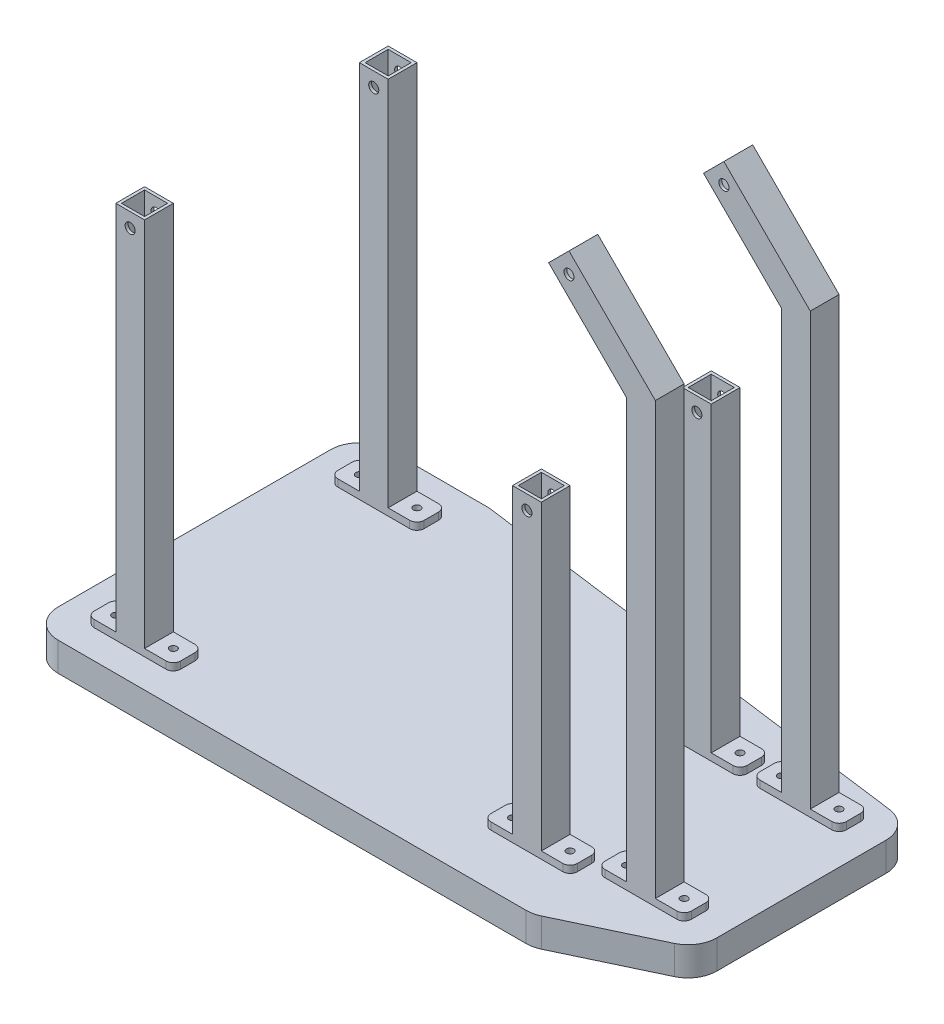
from build123d import *

# Parameters (mm, degrees)
SKETCH4_W               = 25.4
SKETCH4_H               = 25.4
SKETCH4_W_2             = 20.32
SKETCH4_H_2             = 20.32
EXTRUDE_THIN1_DEPTH     = 266.446
EXTRUDE_THIN1_2_DEPTH   = 266.446
SKETCH4_3_W             = 25.4
SKETCH4_3_H             = 25.4
SKETCH4_3_W_2           = 20.32
SKETCH4_3_H_2           = 20.32
EXTRUDE_THIN2_DEPTH     = 327.406
EXTRUDE_THIN2_2_DEPTH   = 327.406
CUT_EXTRUDE1_DEPTH      = 543.779398371
CUT_EXTRUDE1_DEPTH_BACK = 543.779398371
SKETCH3_R               = 4.445
SKETCH5_R               = 4.445
BOSS_EXTRUDE1_DEPTH     = 25.4
CUT_EXTRUDE2_START      = -2.54
CUT_EXTRUDE2_DEPTH      = 20.32
SKETCH7_R               = 3.175
BOSS_EXTRUDE2_DEPTH     = 6.35
BOSS_EXTRUDE3_DEPTH     = 25.4
CUT_EXTRUDE3_DEPTH      = 656.090287432
CUT_EXTRUDE3_DEPTH_BACK = 656.090287432
SKETCH9_R               = 3.175


with BuildPart() as part:
    # Sketch4 → Extrude-Thin1 (new body)
    with BuildSketch(Plane(origin=(0, 31.75, 0), x_dir=(1, 0, 0), z_dir=(0, 1, 0))):
        with Locations((0, 12.7)):
            Rectangle(SKETCH4_W, SKETCH4_H)
        with Locations((0, 12.7)):
            Rectangle(SKETCH4_W_2, SKETCH4_H_2, mode=Mode.SUBTRACT)
    extrude(amount=EXTRUDE_THIN1_DEPTH)


with BuildPart() as body_2:
    # Sketch4 → Extrude-Thin1 2 (new body)
    with BuildSketch(Plane(origin=(0, 31.75, 0), x_dir=(1, 0, 0), z_dir=(0, 1, 0))):
        with Locations((0, 162.56)):
            Rectangle(SKETCH4_W, SKETCH4_H)
        with Locations((0, 162.56)):
            Rectangle(SKETCH4_W_2, SKETCH4_H_2, mode=Mode.SUBTRACT)
    extrude(amount=EXTRUDE_THIN1_2_DEPTH)


with BuildPart() as body_3:
    # Sketch4<3> → Extrude-Thin2 (new body)
    with BuildSketch(Plane(origin=(0, 31.75, 0), x_dir=(1, 0, 0), z_dir=(0, 1, 0))):
        with Locations((-329.692, -7.62)):
            Rectangle(SKETCH4_3_W, SKETCH4_3_H)
        with Locations((-329.692, -7.62)):
            Rectangle(SKETCH4_3_W_2, SKETCH4_3_H_2, mode=Mode.SUBTRACT)
    extrude(amount=EXTRUDE_THIN2_DEPTH)


with BuildPart() as body_4:
    # Sketch4<3> → Extrude-Thin2 2 (new body)
    with BuildSketch(Plane(origin=(0, 31.75, 0), x_dir=(1, 0, 0), z_dir=(0, 1, 0))):
        with Locations((-329.692, 207.264)):
            Rectangle(SKETCH4_3_W, SKETCH4_3_H)
        with Locations((-329.692, 207.264)):
            Rectangle(SKETCH4_3_W_2, SKETCH4_3_H_2, mode=Mode.SUBTRACT)
    extrude(amount=EXTRUDE_THIN2_2_DEPTH)


with BuildPart() as cut_extrude1_tool:
    # Sketch3 → Cut-Extrude1 (new, two sides: drawn at the far end of the back side and taken through both)
    with BuildSketch(Plane.XY.offset(-CUT_EXTRUDE1_DEPTH_BACK)):
        with Locations((0, 285.496)):
            Circle(SKETCH3_R)
        with Locations((23.114, 470.408)):
            Circle(SKETCH3_R)
        with Locations((-329.692, 346.456)):
            Circle(SKETCH3_R)
    extrude(amount=CUT_EXTRUDE1_DEPTH + CUT_EXTRUDE1_DEPTH_BACK)


with BuildPart() as part_1:
    add(part.part)

    # Cut-Extrude1: cut by cut_extrude1_tool
    add(cut_extrude1_tool.part, mode=Mode.SUBTRACT)



with BuildPart() as body_2_1:
    add(body_2.part)

    # Cut-Extrude1: cut by cut_extrude1_tool
    add(cut_extrude1_tool.part, mode=Mode.SUBTRACT)


with BuildPart() as body_3_1:
    add(body_3.part)

    # Cut-Extrude1: cut by cut_extrude1_tool
    add(cut_extrude1_tool.part, mode=Mode.SUBTRACT)


with BuildPart() as body_4_1:
    add(body_4.part)

    # Cut-Extrude1: cut by cut_extrude1_tool
    add(cut_extrude1_tool.part, mode=Mode.SUBTRACT)


with BuildPart() as body_5:
    # Sketch5 → Boss-Extrude1 (new body)
    with BuildSketch(Plane.XY.offset(-39.37)):
        Polygon((5.153487758, 470.408), (73.914, 401.647487758), (73.914, 31.75), (99.314, 31.75), (99.314, 412.168512242), (23.114, 488.368512242), align=None)
        with Locations((23.114, 470.408)):
            Circle(SKETCH5_R, mode=Mode.SUBTRACT)
    extrude(amount=BOSS_EXTRUDE1_DEPTH)

    # Sketch6 → Cut-Extrude2 (cut)
    with BuildSketch(Plane(origin=(0, 0, -39.37), x_dir=(-1, 0, 0), z_dir=(0, 0, -1)).offset(CUT_EXTRUDE2_START)):
        Polygon((-76.454, 402.699590206), (-76.454, 31.75), (-96.774, 31.75), (-96.774, 411.116409794), (-30.298204897, 477.592204897), (-21.317948776, 486.572461018), (-6.949538982, 472.204051224), (-15.929795103, 463.223795103), align=None)
    extrude(amount=-CUT_EXTRUDE2_DEPTH, mode=Mode.SUBTRACT)


with BuildPart() as body_6:
    # Mirror1: mirrored copy
    add(body_5.part.mirror(Plane(origin=(0, 0, -94.996), x_dir=(1, 0, 0), z_dir=(0, 0, -1))))


with BuildPart() as part_2:
    add(part_1.part)

    add(body_2_1.part)  # Boss-Extrude2 merges body 2

    add(body_3_1.part)  # Boss-Extrude2 merges body 3

    add(body_4_1.part)  # Boss-Extrude2 merges body 4

    add(body_5.part)  # Boss-Extrude2 merges body 5

    add(body_6.part)  # Boss-Extrude2 merges body 6
    # Sketch7 → Boss-Extrude2 (add)
    # profile 1 of 6: a face of its own
    with BuildSketch(Plane.XZ.offset(-31.75)):
        with BuildLine():
            Line((-361.442, 20.32), (-297.942, 20.32))
            ThreePointArc((-297.942, 20.32), (-293.451871939, 18.460128061), (-291.592, 13.97))
            Line((-291.592, 13.97), (-291.592, 1.27))
            ThreePointArc((-291.592, 1.27), (-293.451871939, -3.220128061), (-297.942, -5.08))
            Line((-297.942, -5.08), (-361.442, -5.08))
            ThreePointArc((-361.442, -5.08), (-365.932128061, -3.220128061), (-367.792, 1.27))
            Line((-367.792, 1.27), (-367.792, 13.97))
            ThreePointArc((-367.792, 13.97), (-365.932128061, 18.460128061), (-361.442, 20.32))
        make_face()
        with Locations(Location((-355.092, 7.62, 0), (0, 0, 270))):
            Circle(SKETCH7_R, mode=Mode.SUBTRACT)
        with Locations(Location((-304.292, 7.62, 0), (0, 0, 270))):
            Circle(SKETCH7_R, mode=Mode.SUBTRACT)
    # profile 2 of 6: a face of its own
    with BuildSketch(Plane.XZ.offset(-31.75)):
        with BuildLine():
            Line((-291.592, -213.614), (-291.592, -200.914))
            ThreePointArc((-291.592, -200.914), (-293.451871939, -196.423871939), (-297.942, -194.564))
            Line((-297.942, -194.564), (-361.442, -194.564))
            ThreePointArc((-361.442, -194.564), (-365.932128061, -196.423871939), (-367.792, -200.914))
            Line((-367.792, -200.914), (-367.792, -213.614))
            ThreePointArc((-367.792, -213.614), (-365.932128061, -218.104128061), (-361.442, -219.964))
            Line((-361.442, -219.964), (-297.942, -219.964))
            ThreePointArc((-297.942, -219.964), (-293.451871939, -218.104128061), (-291.592, -213.614))
        make_face()
        with Locations(Location((-304.292, -207.264, 0), (0, 0, 90))):
            Circle(SKETCH7_R, mode=Mode.SUBTRACT)
        with Locations(Location((-355.092, -207.264, 0), (0, 0, 90))):
            Circle(SKETCH7_R, mode=Mode.SUBTRACT)
    # profile 3 of 6: a face of its own
    with BuildSketch(Plane.XZ.offset(-31.75)):
        with BuildLine():
            Line((-31.75, 0), (31.75, 0))
            ThreePointArc((31.75, 0), (36.240128061, -1.859871939), (38.1, -6.35))
            Line((38.1, -6.35), (38.1, -19.05))
            ThreePointArc((38.1, -19.05), (36.240128061, -23.540128061), (31.75, -25.4))
            Line((31.75, -25.4), (-31.75, -25.4))
            ThreePointArc((-31.75, -25.4), (-36.240128061, -23.540128061), (-38.1, -19.05))
            Line((-38.1, -19.05), (-38.1, -6.35))
            ThreePointArc((-38.1, -6.35), (-36.240128061, -1.859871939), (-31.75, 0))
        make_face()
        with Locations(Location((-25.4, -12.7, 0), (0, 0, 270))):
            Circle(SKETCH7_R, mode=Mode.SUBTRACT)
        with Locations(Location((25.4, -12.7, 0), (0, 0, 270))):
            Circle(SKETCH7_R, mode=Mode.SUBTRACT)
    # profile 4 of 6: a face of its own
    with BuildSketch(Plane.XZ.offset(-31.75)):
        with BuildLine():
            Line((38.1, -168.91), (38.1, -156.21))
            ThreePointArc((38.1, -156.21), (36.240128061, -151.719871939), (31.75, -149.86))
            Line((31.75, -149.86), (-31.75, -149.86))
            ThreePointArc((-31.75, -149.86), (-36.240128061, -151.719871939), (-38.1, -156.21))
            Line((-38.1, -156.21), (-38.1, -168.91))
            ThreePointArc((-38.1, -168.91), (-36.240128061, -173.400128061), (-31.75, -175.26))
            Line((-31.75, -175.26), (31.75, -175.26))
            ThreePointArc((31.75, -175.26), (36.240128061, -173.400128061), (38.1, -168.91))
        make_face()
        with Locations(Location((25.4, -162.56, 0), (0, 0, 90))):
            Circle(SKETCH7_R, mode=Mode.SUBTRACT)
        with Locations(Location((-25.4, -162.56, 0), (0, 0, 90))):
            Circle(SKETCH7_R, mode=Mode.SUBTRACT)
    # profile 5 of 6: a face of its own
    with BuildSketch(Plane.XZ.offset(-31.75)):
        with BuildLine():
            Line((54.864, -13.97), (118.364, -13.97))
            ThreePointArc((118.364, -13.97), (122.854128061, -15.829871939), (124.714, -20.32))
            Line((124.714, -20.32), (124.714, -33.02))
            ThreePointArc((124.714, -33.02), (122.854128061, -37.510128061), (118.364, -39.37))
            Line((118.364, -39.37), (54.864, -39.37))
            ThreePointArc((54.864, -39.37), (50.373871939, -37.510128061), (48.514, -33.02))
            Line((48.514, -33.02), (48.514, -20.32))
            ThreePointArc((48.514, -20.32), (50.373871939, -15.829871939), (54.864, -13.97))
        make_face()
        with Locations(Location((61.214, -26.67, 0), (0, 0, 270))):
            Circle(SKETCH7_R, mode=Mode.SUBTRACT)
        with Locations(Location((112.014, -26.67, 0), (0, 0, 270))):
            Circle(SKETCH7_R, mode=Mode.SUBTRACT)
    # profile 6 of 6: a face of its own
    with BuildSketch(Plane.XZ.offset(-31.75)):
        with BuildLine():
            Line((124.714, -169.672), (124.714, -156.972))
            ThreePointArc((124.714, -156.972), (122.854128061, -152.481871939), (118.364, -150.622))
            Line((118.364, -150.622), (54.864, -150.622))
            ThreePointArc((54.864, -150.622), (50.373871939, -152.481871939), (48.514, -156.972))
            Line((48.514, -156.972), (48.514, -169.672))
            ThreePointArc((48.514, -169.672), (50.373871939, -174.162128061), (54.864, -176.022))
            Line((54.864, -176.022), (118.364, -176.022))
            ThreePointArc((118.364, -176.022), (122.854128061, -174.162128061), (124.714, -169.672))
        make_face()
        with Locations(Location((112.014, -163.322, 0), (0, 0, 90))):
            Circle(SKETCH7_R, mode=Mode.SUBTRACT)
        with Locations(Location((61.214, -163.322, 0), (0, 0, 90))):
            Circle(SKETCH7_R, mode=Mode.SUBTRACT)
    extrude(amount=BOSS_EXTRUDE2_DEPTH)


with BuildPart() as body_2_2:
    # Sketch8 → Boss-Extrude3 (new body)
    with BuildSketch(Plane.XZ.offset(-25.4)):
        with BuildLine():
            Line((-367.792, 45.72), (45.094266108, 45.72))
            ThreePointArc((45.094266108, 45.72), (50.661270354, 45.102422475), (55.957561473, 43.279721554))
            Line((55.957561473, 43.279721554), (135.577295364, 5.607980454))
            ThreePointArc((135.577295364, 5.607980454), (146.174285439, -3.764388566), (150.114, -17.3517411))
            Line((150.114, -17.3517411), (150.114, -166.455150462))
            ThreePointArc((150.114, -166.455150462), (143.813844342, -183.198983539), (128.038728653, -191.636615459))
            Line((128.038728653, -191.636615459), (-277.236817846, -245.145464997))
            ThreePointArc((-277.236817846, -245.145464997), (-278.895594957, -245.309307366), (-280.561546499, -245.364))
            Line((-280.561546499, -245.364), (-367.792, -245.364))
            ThreePointArc((-367.792, -245.364), (-385.752512242, -237.924512242), (-393.192, -219.964))
            Line((-393.192, -219.964), (-393.192, 20.32))
            ThreePointArc((-393.192, 20.32), (-385.752512242, 38.280512242), (-367.792, 45.72))
        make_face()
    extrude(amount=BOSS_EXTRUDE3_DEPTH)

    # Sketch9 → Cut-Extrude3 (cut, two sides: drawn at the far end of the back side and taken through both)
    with BuildSketch(Plane(origin=(0, 25.4, 0), x_dir=(1, 0, 0), z_dir=(0, 1, 0)).offset(-CUT_EXTRUDE3_DEPTH_BACK)):
        with Locations(Location((-355.092, 207.264, 0), (0, 0, 270))):
            Circle(SKETCH9_R)
        with Locations(Location((-304.292, 207.264, 0), (0, 0, 270))):
            Circle(SKETCH9_R)
        with Locations(Location((-25.4, 162.56, 0), (0, 0, 270))):
            Circle(SKETCH9_R)
        with Locations(Location((112.014, 163.322, 0), (0, 0, 270))):
            Circle(SKETCH9_R)
        with Locations(Location((25.4, 162.56, 0), (0, 0, 270))):
            Circle(SKETCH9_R)
        with Locations(Location((61.214, 163.322, 0), (0, 0, 270))):
            Circle(SKETCH9_R)
        with Locations(Location((-25.4, 12.7, 0), (0, 0, 270))):
            Circle(SKETCH9_R)
        with Locations(Location((25.4, 12.7, 0), (0, 0, 270))):
            Circle(SKETCH9_R)
        with Locations(Location((61.214, 26.67, 0), (0, 0, 270))):
            Circle(SKETCH9_R)
        with Locations(Location((112.014, 26.67, 0), (0, 0, 270))):
            Circle(SKETCH9_R)
        with Locations(Location((-355.092, -7.62, 0), (0, 0, 270))):
            Circle(SKETCH9_R)
        with Locations(Location((-304.292, -7.62, 0), (0, 0, 270))):
            Circle(SKETCH9_R)
    extrude(amount=CUT_EXTRUDE3_DEPTH + CUT_EXTRUDE3_DEPTH_BACK, mode=Mode.SUBTRACT)


solid = Compound([part_2.part, body_2_2.part])
